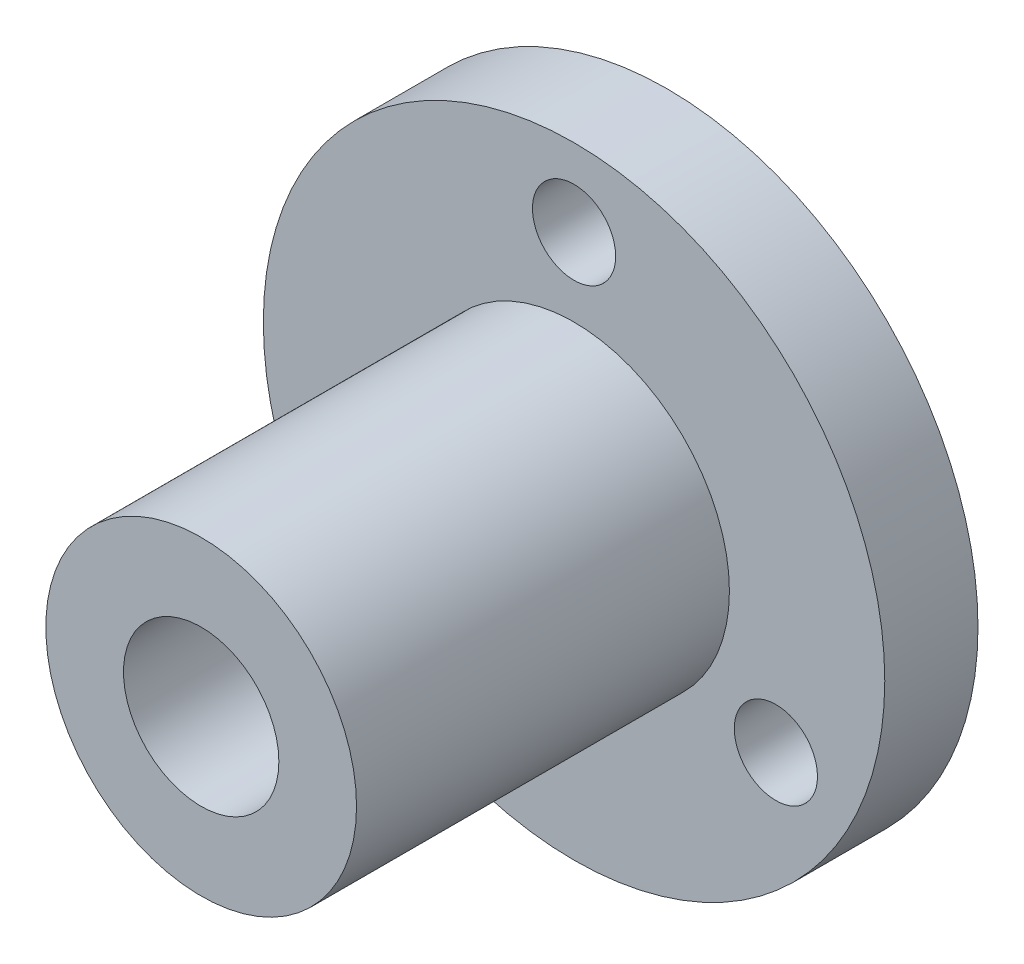
from build123d import *

# Parameters (mm, degrees)
SCHIZZO1_R                   = 12.7
ESTRUSIONE_ESTRUSIONE1_DEPTH = 3.81
SCHIZZO2_R                   = 6.35
ESTRUSIONE_ESTRUSIONE2_DEPTH = 15.24
FORI_ALESATO_4_0MM1_D        = 6.35
FORO_PER_VITE_M3_1_D         = 3.4
RIPETIZIONECIRCOLARE2_COUNT  = 3


with BuildPart() as part:
    # Schizzo1 → Estrusione-Estrusione1 (new body)
    with BuildSketch(Plane(origin=(0, 0, 0), x_dir=(0, 1, 0), z_dir=(0, 0, 1))):
        with Locations(Location((0, 0, 0), (0, 0, 270))):
            Circle(SCHIZZO1_R)
    extrude(amount=ESTRUSIONE_ESTRUSIONE1_DEPTH)

    # Schizzo2 → Estrusione-Estrusione2 (add)
    with BuildSketch(Plane.XY.offset(3.81)):
        Circle(SCHIZZO2_R)
    extrude(amount=ESTRUSIONE_ESTRUSIONE2_DEPTH)

    # Fori Alesato Ø4.0mm1 (through all)
    with Locations(Plane.XY.offset(19.05)):
        with Locations((0, 0)):
            Hole(FORI_ALESATO_4_0MM1_D / 2)

    # Foro per Vite M3-1 (through all)
    with Locations(Plane.XY.offset(3.81)):
        with Locations((0, 9.525)):
            foro_per_vite_m3_1 = Hole(FORO_PER_VITE_M3_1_D / 2)

    # RipetizioneCircolare2: Foro per Vite M3-1 ×3 about axis
    ripetizionecircolare2_axis = Axis((0, 0, 0), (0, 0, 1))
    for i in range(1, RIPETIZIONECIRCOLARE2_COUNT):
        add(foro_per_vite_m3_1.rotate(ripetizionecircolare2_axis, i * 360 / RIPETIZIONECIRCOLARE2_COUNT), mode=Mode.SUBTRACT)


solid = part.part
